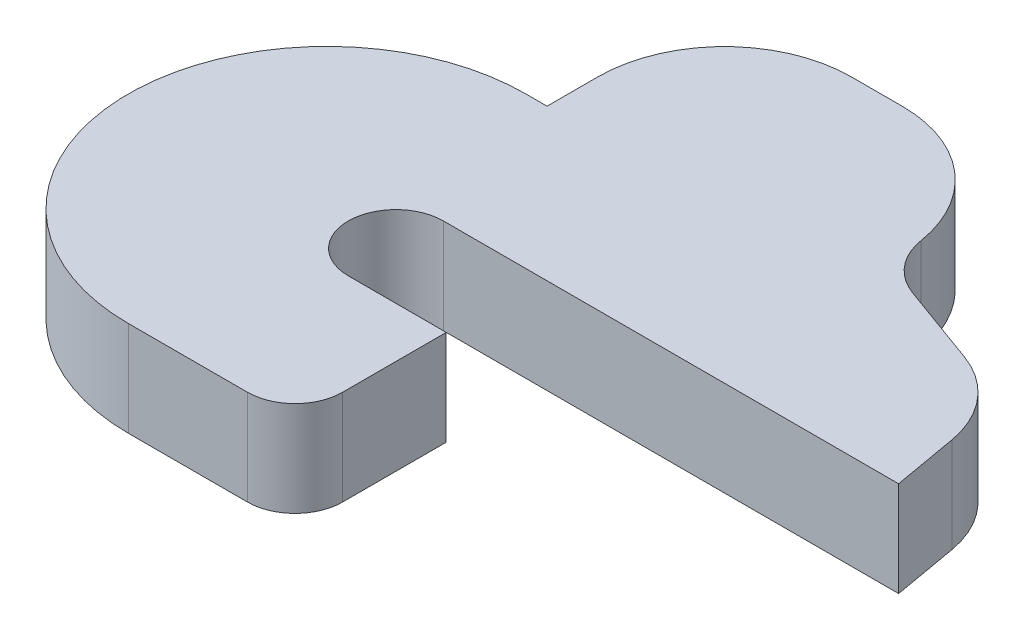
from build123d import *

# Parameters (mm, degrees)
BOSS_EXTRUDE2_DEPTH = 3


with BuildPart() as part:
    # Sketch1 → Boss-Extrude2 (new body)
    with BuildSketch(Plane(origin=(0, 0, 0), x_dir=(1, 0, 0), z_dir=(0, 1, 0))):
        with BuildLine():
            Line((0, 0), (-3.09, 0))
            ThreePointArc((-3.09, 0), (-4.59, 1.5), (-3.09, 3))
            Line((-3.09, 3), (11.27, 3))
            Line((11.27, 3), (10.908822115, 5.04834157))
            ThreePointArc((10.908822115, 5.04834157), (10.208482238, 6.549941992), (8.851032589, 7.5))
            Line((8.851032589, 7.5), (6.27, 8.438574292))
            ThreePointArc((6.27, 8.438574292), (5.411457646, 9.044534587), (4.978627211, 10.002104777))
            ThreePointArc((4.978627211, 10.002104777), (3.62422767, 12.413716405), (1.02888753, 13.37))
            Line((1.02888753, 13.37), (-0.59, 13.37))
            ThreePointArc((-0.59, 13.37), (-3.418427125, 12.198427125), (-4.59, 9.37))
            Line((-4.59, 9.37), (-4.59, 7.77))
            Line((-4.59, 7.77), (-5.26, 7.77))
            ThreePointArc((-5.26, 7.77), (-11.53, 1.5), (-5.26, -4.77))
            Line((-5.26, -4.77), (-1.5, -4.77))
            ThreePointArc((-1.5, -4.77), (-0.439339828, -4.330660172), (0, -3.27))
            Line((0, -3.27), (0, 0))
        make_face()
    extrude(amount=BOSS_EXTRUDE2_DEPTH)


solid = part.part
